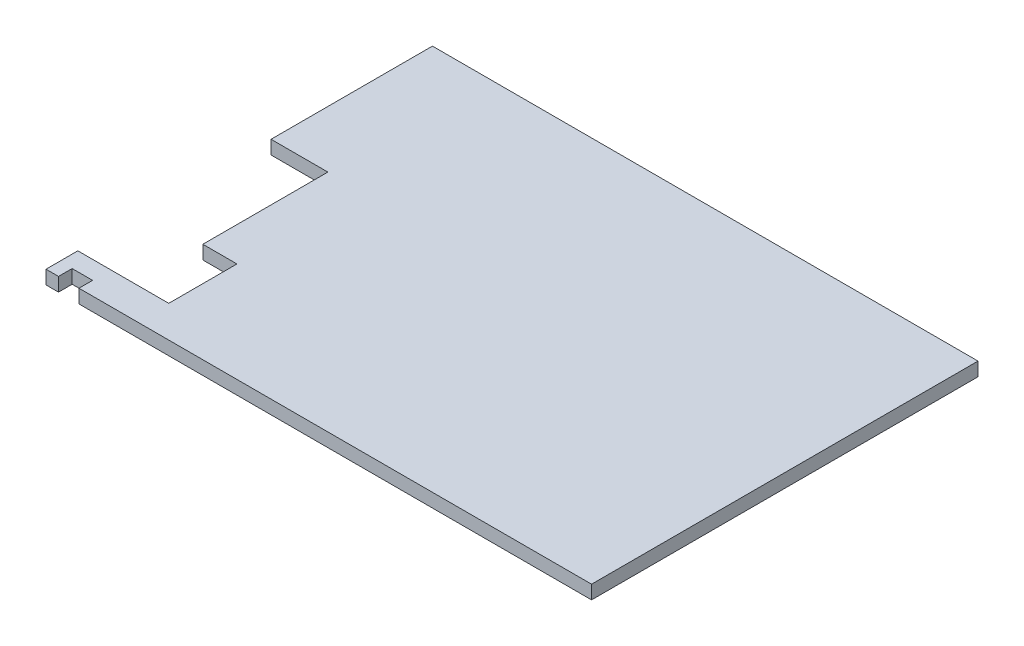
from build123d import *

# Parameters (mm, degrees)
BOSS_EXTRUDE1_DEPTH = 6


with BuildPart() as part:
    # Sketch1 → Boss-Extrude1 (new body)
    with BuildSketch(Plane(origin=(0, 0, 0), x_dir=(1, 0, 0), z_dir=(0, 1, 0))):
        Polygon((14.5, 4.796692747), (240, 4.796692747), (240, 174.796692747), (0, 174.796692747), (0, 103.796692747), (25, 103.796692747), (25, 48.796692747), (40, 48.796692747), (40, 18.796692747), (25, 18.796692747), (18.804365786, 18.796692747), (0, 18.796692747), (0, 4.796692747), (5.5, 4.796692747), (5.5, 10.796692747), (14.5, 10.796692747), align=None)
    extrude(amount=BOSS_EXTRUDE1_DEPTH)


solid = part.part
